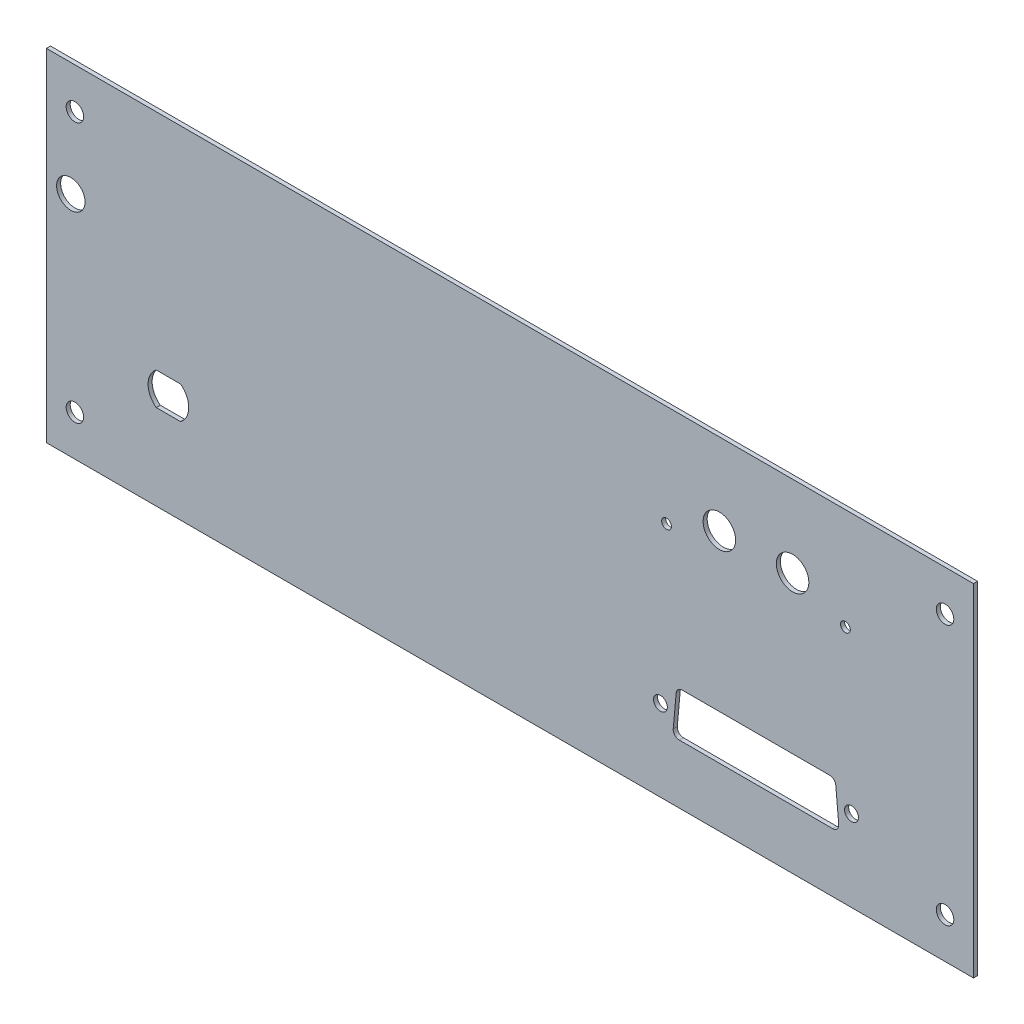
from build123d import *

# Parameters (mm, degrees)
SKETCH_1_W          = 228
SKETCH_1_H          = 84
SKETCH_1_R          = 2.15
EXTRUDE_1_DEPTH     = 1
SKETCH_3_R          = 1.7
SKETCH_3_R_2        = 1.2
SKETCH_3_R_3        = 4
CUT_EXTRUDE_1_DEPTH = 10
SKETCH_4_R          = 3.5
CUT_EXTRUDE_2_DEPTH = 1


with BuildPart() as part:
    # Эскиз1 → Вытянуть1 (new body)
    with BuildSketch(Plane.XY):
        Rectangle(SKETCH_1_W, SKETCH_1_H)
        with Locations((107, 32)):
            Circle(SKETCH_1_R, mode=Mode.SUBTRACT)
        with Locations(Location((-107, 32, 0), (0, 0, 180))):
            Circle(SKETCH_1_R, mode=Mode.SUBTRACT)
        with Locations((-107, -32)):
            Circle(SKETCH_1_R, mode=Mode.SUBTRACT)
        with Locations(Location((107, -32, 0), (0, 0, 180))):
            Circle(SKETCH_1_R, mode=Mode.SUBTRACT)
    extrude(amount=EXTRUDE_1_DEPTH)

    # Эскиз3 → Вырез-Вытянуть1 (cut)
    with BuildSketch(Plane.XY.offset(1)):
        with Locations((37, -22)):
            Circle(SKETCH_3_R)
        with Locations((84, -22)):
            Circle(SKETCH_3_R)
        with Locations((38.5, 17)):
            Circle(SKETCH_3_R_2)
        with Locations((82.5, 17)):
            Circle(SKETCH_3_R_2)
        with Locations((51.5, 22)):
            Circle(SKETCH_3_R_3)
        with Locations((69.5, 22)):
            Circle(SKETCH_3_R_3)
        with BuildLine():
            Line((40.14870942, -25.864196381), (40.875982147, -17.864196381))
            ThreePointArc((40.875982147, -17.864196381), (41.358314525, -16.892366164), (42.369821957, -16.5))
            Line((42.369821957, -16.5), (78.630178043, -16.5))
            ThreePointArc((78.630178043, -16.5), (79.641685475, -16.892366164), (80.124017853, -17.864196381))
            Line((80.124017853, -17.864196381), (80.85129058, -25.864196381))
            ThreePointArc((80.85129058, -25.864196381), (80.465084606, -27.011507432), (79.35745077, -27.5))
            Line((79.35745077, -27.5), (41.64254923, -27.5))
            ThreePointArc((41.64254923, -27.5), (40.534915394, -27.011507432), (40.14870942, -25.864196381))
        make_face()
    extrude(amount=-CUT_EXTRUDE_1_DEPTH, mode=Mode.SUBTRACT)

    # Эскиз4 → Вырез-Вытянуть2 (cut)
    with BuildSketch(Plane.XY.offset(1)):
        with Locations((-108, 14)):
            Circle(SKETCH_4_R)
        with BuildLine():
            Line((-87, -13), (-81, -13))
            ThreePointArc((-81, -13), (-79, -17), (-81, -21))
            Line((-81, -21), (-87, -21))
            ThreePointArc((-87, -21), (-89, -17), (-87, -13))
        make_face()
    extrude(amount=-CUT_EXTRUDE_2_DEPTH, mode=Mode.SUBTRACT)


solid = part.part
